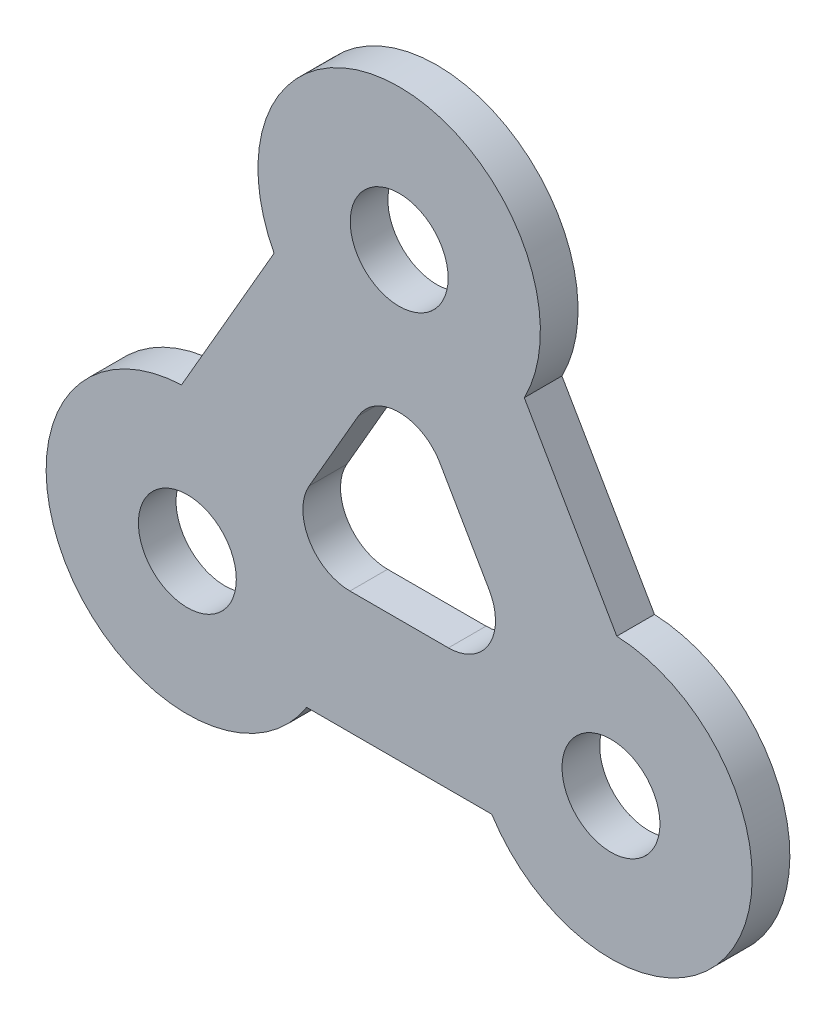
from build123d import *

# Parameters (mm, degrees)
SKETCH_1_R      = 5.2
EXTRUDE_1_DEPTH = 4


with BuildPart() as part:
    # 草图1 → 凸台-拉伸1 (new body)
    with BuildSketch(Plane.XY):
        with BuildLine():
            Line((-18.494622549, 4.742999843), (-23.409453688, -3.769737399))
            ThreePointArc((-23.409453688, -3.769737399), (-35.781809628, -26.257000157), (-10.121090849, -26.785856986))
            Line((-10.121090849, -26.785856986), (-0.291428571, -26.785856986))
            Line((-0.291428571, -26.785856986), (9.538233706, -26.785856986))
            ThreePointArc((9.538233706, -26.785856986), (35.198952485, -26.257000157), (22.826596545, -3.769737399))
            Line((22.826596545, -3.769737399), (17.911765406, 4.742999843))
            Line((17.911765406, 4.742999843), (12.996934268, 13.255737086))
            ThreePointArc((12.996934268, 13.255737086), (-0.291428571, 35.214143014), (-13.579791411, 13.255737086))
            Line((-13.579791411, 13.255737086), (-18.494622549, 4.742999843))
        make_face()
        with Locations((-0.291428571, 20.214143014)):
            Circle(SKETCH_1_R, mode=Mode.SUBTRACT)
        with Locations((22.208571429, -18.757000157)):
            Circle(SKETCH_1_R, mode=Mode.SUBTRACT)
        with Locations((-22.791428571, -18.757000157)):
            Circle(SKETCH_1_R, mode=Mode.SUBTRACT)
        with BuildLine():
            Line((9.268171867, -6.285856986), (4.038698447, 2.771856673))
            ThreePointArc((4.038698447, 2.771856673), (-0.291428571, 5.271856673), (-4.62155559, 2.771856673))
            Line((-4.62155559, 2.771856673), (-9.85102901, -6.285856986))
            ThreePointArc((-9.85102901, -6.285856986), (-9.85102901, -11.285856986), (-5.520901991, -13.785856986))
            Line((-5.520901991, -13.785856986), (4.938044848, -13.785856986))
            ThreePointArc((4.938044848, -13.785856986), (9.268171867, -11.285856986), (9.268171867, -6.285856986))
        make_face(mode=Mode.SUBTRACT)
    extrude(amount=EXTRUDE_1_DEPTH)


solid = part.part
